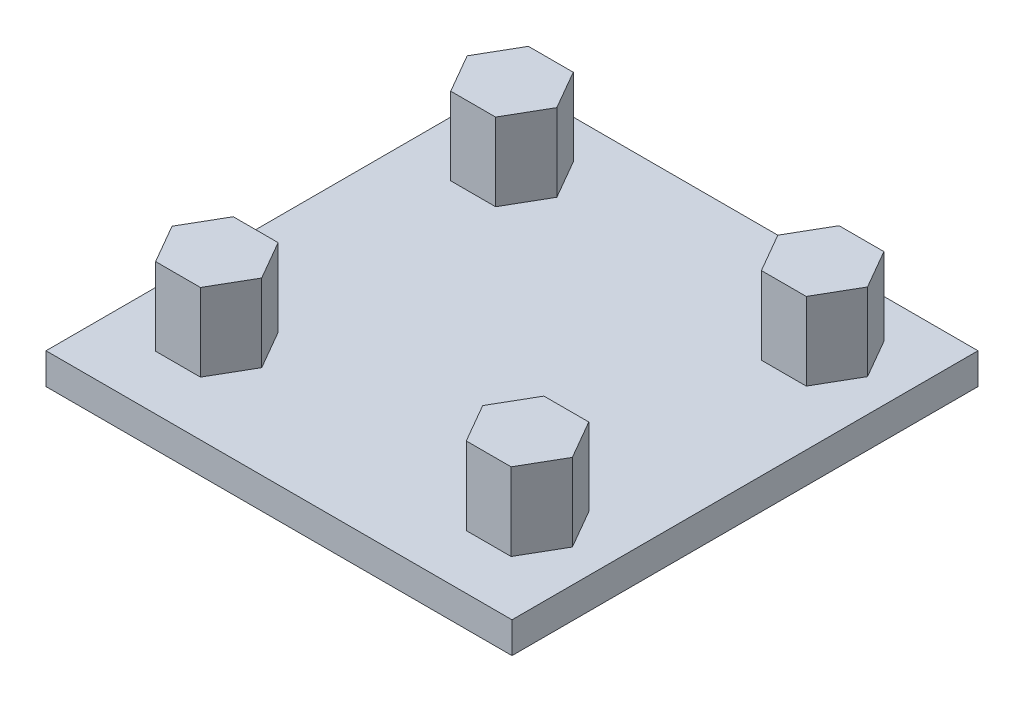
from build123d import *

# Parameters (mm, degrees)
SKETCH1_W            = 76.2
SKETCH1_H            = 76.2
BOSS_EXTRUDE1_DEPTH  = 5.08
BOSS_EXTRUDE2_DEPTH  = 12.7
LPATTERN1_COUNT      = 2
LPATTERN1_PITCH      = 50.8
LPATTERN1_COUNT_DIR2 = 2
LPATTERN1_PITCH_DIR2 = 48.26


with BuildPart() as part:
    # Sketch1 → Boss-Extrude1 (new body)
    with BuildSketch(Plane(origin=(0, 0, 0), x_dir=(1, 0, 0), z_dir=(0, 1, 0))):
        Rectangle(SKETCH1_W, SKETCH1_H)
    extrude(amount=BOSS_EXTRUDE1_DEPTH)

    # Sketch2 → Boss-Extrude2 (add)
    with BuildSketch(Plane(origin=(0, 5.08, 0), x_dir=(1, 0, 0), z_dir=(0, 1, 0))):
        Polygon((-21.733825791, 19.05), (-18.067651581, 25.4), (-21.733825791, 31.75), (-29.066174209, 31.75), (-32.732348419, 25.4), (-29.066174209, 19.05), align=None)
    boss_extrude2 = extrude(amount=BOSS_EXTRUDE2_DEPTH)

    # LPattern1: Boss-Extrude2 2 × 2
    with Locations(*[(i * LPATTERN1_PITCH, 0, j * LPATTERN1_PITCH_DIR2) for i in range(LPATTERN1_COUNT) for j in range(LPATTERN1_COUNT_DIR2) if (i, j) != (0, 0)]):
        add(boss_extrude2)


solid = part.part
